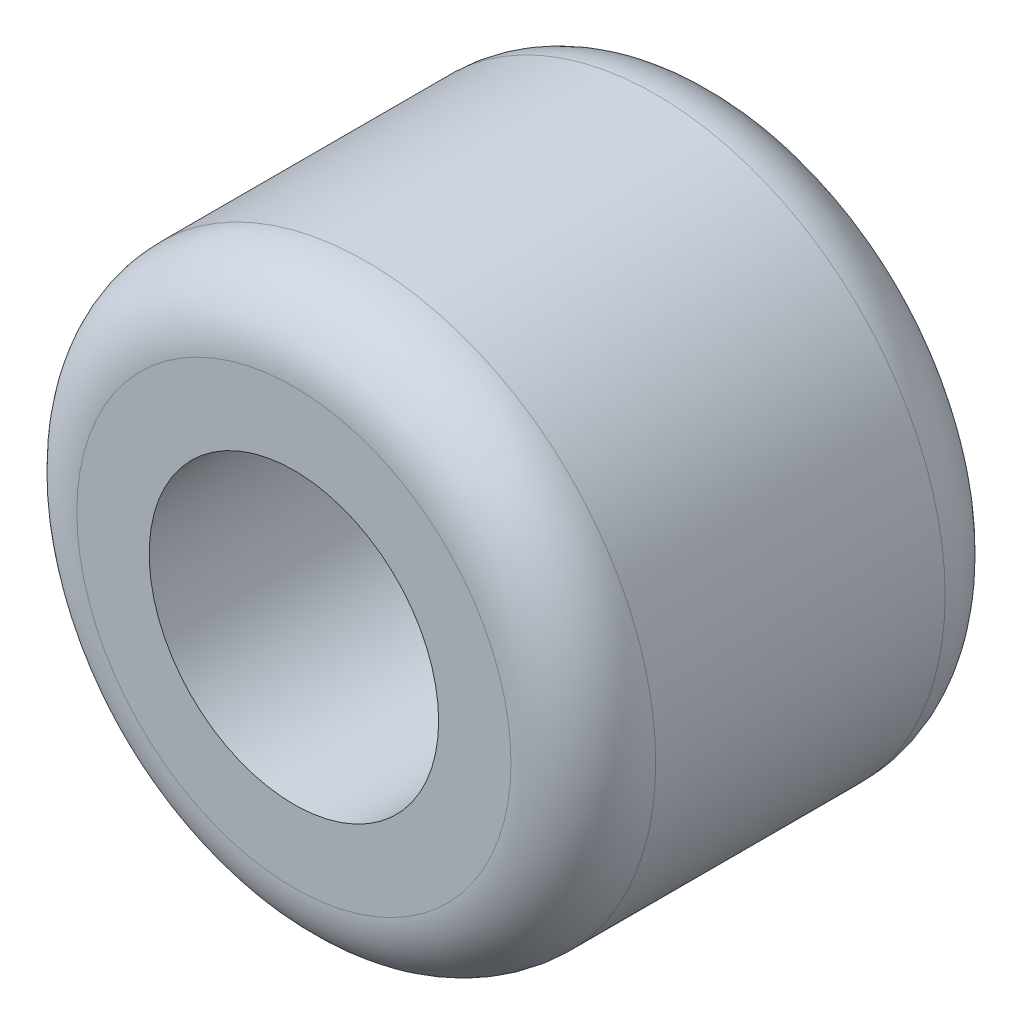
from build123d import *

# Parameters (mm, degrees)
SKETCH_1_R      = 4
SKETCH_1_R_2    = 2
EXTRUDE_1_DEPTH = 6
FILLET_1_R      = 1
FILLET_2_R      = 1


with BuildPart() as part:
    # 草图1 → 凸台-拉伸1 (new body)
    with BuildSketch(Plane.XY):
        Circle(SKETCH_1_R)
        Circle(SKETCH_1_R_2, mode=Mode.SUBTRACT)
    extrude(amount=EXTRUDE_1_DEPTH)

    # 圆角1
    fillet_1_edges = [part.edges().sort_by_distance(p)[0] for p in [
        (-4, 0, 6),
    ]]
    fillet(fillet_1_edges, radius=FILLET_1_R)

    # 圆角2
    fillet_2_edges = [part.edges().sort_by_distance(p)[0] for p in [
        (-4, 0, 0),
    ]]
    fillet(fillet_2_edges, radius=FILLET_2_R)


solid = part.part
